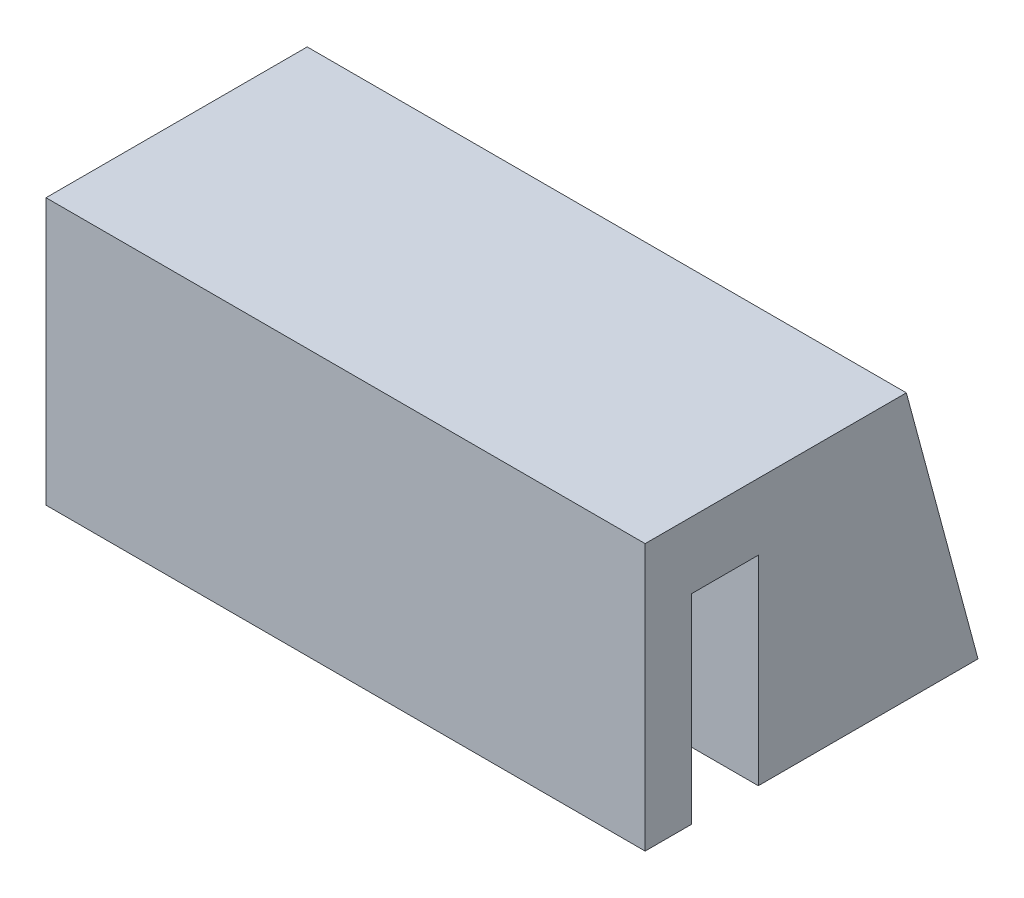
from build123d import *

# Parameters (mm, degrees)
SKETCH2_W           = 45
SKETCH2_H           = 20
BOSS_EXTRUDE1_DEPTH = 25
CUT_EXTRUDE1_START  = -20
SKETCH5_W           = 45
SKETCH5_H           = 5
CUT_EXTRUDE1_DEPTH  = 15
CUT_EXTRUDE2_DEPTH  = 45
SKETCH8_W           = 38.3
SKETCH8_H           = 9.6
CUT_EXTRUDE3_DEPTH  = 10
CUT_EXTRUDE4_REACH  = 41.131
SKETCH9_W           = 19.5
SKETCH9_H           = 16.5


with BuildPart() as part:
    # Sketch2 → Boss-Extrude1 (new body)
    with BuildSketch(Plane.XY):
        Rectangle(SKETCH2_W, SKETCH2_H)
    extrude(amount=BOSS_EXTRUDE1_DEPTH)

    # Sketch5 → Cut-Extrude1 (cut)
    with BuildSketch(Plane(origin=(0, 10, 0), x_dir=(1, 0, 0), z_dir=(0, 1, 0)).offset(CUT_EXTRUDE1_START)):
        with Locations((0, -19)):
            Rectangle(SKETCH5_W, SKETCH5_H)
    extrude(amount=CUT_EXTRUDE1_DEPTH, mode=Mode.SUBTRACT)

    # Sketch7 → Cut-Extrude2 (cut)
    with BuildSketch(Plane(origin=(22.5, 0, 0), x_dir=(0, 0, -1), z_dir=(1, 0, 0))):
        Polygon((0, -10), (0, 10), (-5.381576505, 10), align=None)
    extrude(amount=-CUT_EXTRUDE2_DEPTH, mode=Mode.SUBTRACT)

    # Sketch8 → Cut-Extrude3 (cut)
    with BuildSketch(Plane(origin=(0, -0.675150911, 2.509119438), x_dir=(-1, 0, 0), z_dir=(0, 0.25983666232132585, -0.9656525818914965))):
        Rectangle(SKETCH8_W, SKETCH8_H)
    extrude(amount=-CUT_EXTRUDE3_DEPTH, mode=Mode.SUBTRACT)

    # Cut-Extrude4: up to this plane
    cut_extrude4_end = Plane(origin=(19.15, 1.361614859, 13.412861236), z_dir=(0, 0.9656525818914965, 0.25983666232132585))
    # Sketch9 → Cut-Extrude4 (cut, up to the surface)
    with BuildSketch(Plane.XZ.offset(10), mode=Mode.PRIVATE) as cut_extrude4_sk1:
        with Locations((5.75, 8.25)):
            Rectangle(SKETCH9_W, SKETCH9_H)
    cut_extrude4_tool1 = split(extrude(cut_extrude4_sk1.sketch, amount=-CUT_EXTRUDE4_REACH, mode=Mode.PRIVATE), bisect_by=cut_extrude4_end, keep=Keep.BOTH, mode=Mode.PRIVATE)
    add(cut_extrude4_tool1.solids().sort_by_distance((5.75, -10, 8.25))[0], mode=Mode.SUBTRACT)


solid = part.part
